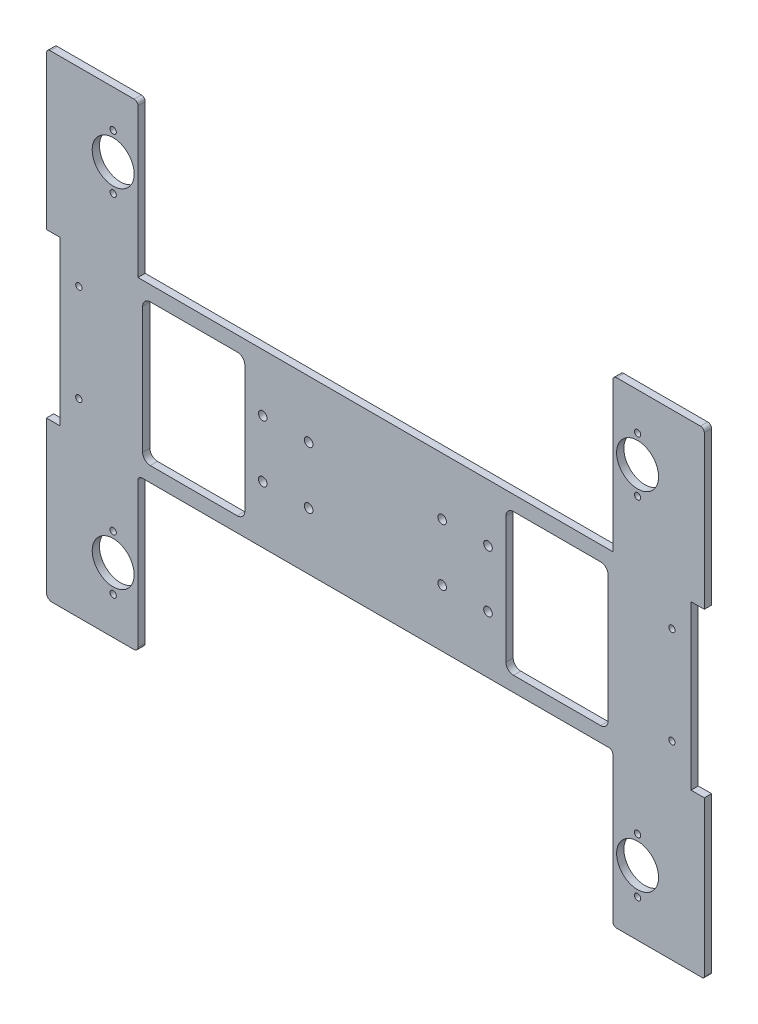
from build123d import *

# Parameters (mm, degrees)
SKETCH2_R           = 1.65
SKETCH2_R_2         = 11
SKETCH2_R_3         = 2.25
BOSS_EXTRUDE1_DEPTH = 3.8


with BuildPart() as part:
    # Sketch2 → Boss-Extrude1 (new body)
    with BuildSketch(Plane.XY):
        with BuildLine():
            Line((-170.5, 150), (-126.5, 150))
            ThreePointArc((-126.5, 150), (-125.085786438, 149.414213562), (-124.5, 148))
            Line((-124.5, 148), (-124.5, 70))
            Line((-124.5, 70), (124.5, 70))
            Line((124.5, 70), (124.5, 148))
            ThreePointArc((124.5, 148), (125.085786438, 149.414213562), (126.5, 150))
            Line((126.5, 150), (170.5, 150))
            ThreePointArc((170.5, 150), (171.914213562, 149.414213562), (172.5, 148))
            Line((172.5, 148), (172.5, 67.8042249))
            Line((172.5, 67.8042249), (165.5, 67.8042249))
            Line((165.5, 67.8042249), (165.5, -17.8042249))
            Line((165.5, -17.8042249), (172.5, -17.8042249))
            Line((172.5, -17.8042249), (172.5, -99))
            ThreePointArc((172.5, -99), (172.207106781, -99.707106781), (171.5, -100))
            Line((171.5, -100), (126.5, -100))
            ThreePointArc((126.5, -100), (125.085786438, -99.414213562), (124.5, -98))
            Line((124.5, -98), (124.5, -22))
            ThreePointArc((124.5, -22), (123.914213562, -20.585786438), (122.5, -20))
            Line((122.5, -20), (-122.5, -20))
            ThreePointArc((-122.5, -20), (-123.914213562, -20.585786438), (-124.5, -22))
            Line((-124.5, -22), (-124.5, -98))
            ThreePointArc((-124.5, -98), (-125.085786438, -99.414213562), (-126.5, -100))
            Line((-126.5, -100), (-169.5, -100))
            ThreePointArc((-169.5, -100), (-171.621320344, -99.121320344), (-172.5, -97))
            Line((-172.5, -97), (-172.5, -17.8042249))
            Line((-172.5, -17.8042249), (-165.5, -17.8042249))
            Line((-165.5, -17.8042249), (-165.5, 67.8042249))
            Line((-165.5, 67.8042249), (-172.5, 67.8042249))
            Line((-172.5, 67.8042249), (-172.5, 148))
            ThreePointArc((-172.5, 148), (-171.914213562, 149.414213562), (-170.5, 150))
        make_face()
        with Locations(Location((-137.5, 130.334802826, 0), (0, 0, 180))):
            Circle(SKETCH2_R, mode=Mode.SUBTRACT)
        with Locations(Location((-137.5, 101.665197174, 0), (0, 0, 180))):
            Circle(SKETCH2_R, mode=Mode.SUBTRACT)
        with Locations(Location((137.5, 130.334802826, 0), (0, 0, 180))):
            Circle(SKETCH2_R, mode=Mode.SUBTRACT)
        with Locations(Location((137.5, 101.665197174, 0), (0, 0, 180))):
            Circle(SKETCH2_R, mode=Mode.SUBTRACT)
        with Locations(Location((137.5, 116, 0), (0, 0, 180))):
            Circle(SKETCH2_R_2, mode=Mode.SUBTRACT)
        with Locations(Location((-137.5, 116, 0), (0, 0, 180))):
            Circle(SKETCH2_R_2, mode=Mode.SUBTRACT)
        with Locations(Location((155.5, -0.5, 0), (0, 0, 180))):
            Circle(SKETCH2_R, mode=Mode.SUBTRACT)
        with Locations(Location((155.5, 50.5, 0), (0, 0, 180))):
            Circle(SKETCH2_R, mode=Mode.SUBTRACT)
        with Locations(Location((-155.5, -0.5, 0), (0, 0, 180))):
            Circle(SKETCH2_R, mode=Mode.SUBTRACT)
        with Locations(Location((-155.5, 50.5, 0), (0, 0, 180))):
            Circle(SKETCH2_R, mode=Mode.SUBTRACT)
        with Locations(Location((-35, 10.055, 0), (0, 0, 180))):
            Circle(SKETCH2_R_3, mode=Mode.SUBTRACT)
        with Locations(Location((-35, 39.945, 0), (0, 0, 180))):
            Circle(SKETCH2_R_3, mode=Mode.SUBTRACT)
        with Locations(Location((-59.06, 39.945, 0), (0, 0, 180))):
            Circle(SKETCH2_R_3, mode=Mode.SUBTRACT)
        with Locations(Location((-59.06, 10.055, 0), (0, 0, 180))):
            Circle(SKETCH2_R_3, mode=Mode.SUBTRACT)
        with Locations(Location((59.06, 10.055, 0), (0, 0, 180))):
            Circle(SKETCH2_R_3, mode=Mode.SUBTRACT)
        with Locations(Location((35, 10.055, 0), (0, 0, 180))):
            Circle(SKETCH2_R_3, mode=Mode.SUBTRACT)
        with Locations(Location((35, 39.945, 0), (0, 0, 180))):
            Circle(SKETCH2_R_3, mode=Mode.SUBTRACT)
        with Locations(Location((59.06, 39.945, 0), (0, 0, 180))):
            Circle(SKETCH2_R_3, mode=Mode.SUBTRACT)
        with Locations(Location((137.5, -80.334802826, 0), (0, 0, 180))):
            Circle(SKETCH2_R, mode=Mode.SUBTRACT)
        with Locations(Location((137.5, -51.665197174, 0), (0, 0, 180))):
            Circle(SKETCH2_R, mode=Mode.SUBTRACT)
        with Locations(Location((137.5, -66, 0), (0, 0, 180))):
            Circle(SKETCH2_R_2, mode=Mode.SUBTRACT)
        with Locations(Location((-137.5, -66, 0), (0, 0, 180))):
            Circle(SKETCH2_R_2, mode=Mode.SUBTRACT)
        with Locations(Location((-137.5, -51.665197174, 0), (0, 0, 180))):
            Circle(SKETCH2_R, mode=Mode.SUBTRACT)
        with Locations(Location((-137.5, -80.334802826, 0), (0, 0, 180))):
            Circle(SKETCH2_R, mode=Mode.SUBTRACT)
        with BuildLine():
            Line((-72.45742566, 62.171403079), (-118.05517368, 62.171403079))
            ThreePointArc((-118.05517368, 62.171403079), (-120.883600805, 60.999830204), (-122.05517368, 58.171403079))
            Line((-122.05517368, 58.171403079), (-122.05517368, -8.171403079))
            ThreePointArc((-122.05517368, -8.171403079), (-120.883600805, -10.999830204), (-118.05517368, -12.171403079))
            Line((-118.05517368, -12.171403079), (-72.45742566, -12.171403079))
            ThreePointArc((-72.45742566, -12.171403079), (-69.628998535, -10.999830204), (-68.45742566, -8.171403079))
            Line((-68.45742566, -8.171403079), (-68.45742566, 58.171403079))
            ThreePointArc((-68.45742566, 58.171403079), (-69.628998535, 60.999830204), (-72.45742566, 62.171403079))
        make_face(mode=Mode.SUBTRACT)
        with BuildLine():
            Line((72.45742566, 62.171403079), (118.05517368, 62.171403079))
            ThreePointArc((118.05517368, 62.171403079), (120.883600805, 60.999830204), (122.05517368, 58.171403079))
            Line((122.05517368, 58.171403079), (122.05517368, -8.171403079))
            ThreePointArc((122.05517368, -8.171403079), (120.883600805, -10.999830204), (118.05517368, -12.171403079))
            Line((118.05517368, -12.171403079), (72.45742566, -12.171403079))
            ThreePointArc((72.45742566, -12.171403079), (69.628998535, -10.999830204), (68.45742566, -8.171403079))
            Line((68.45742566, -8.171403079), (68.45742566, 58.171403079))
            ThreePointArc((68.45742566, 58.171403079), (69.628998535, 60.999830204), (72.45742566, 62.171403079))
        make_face(mode=Mode.SUBTRACT)
    extrude(amount=BOSS_EXTRUDE1_DEPTH)


solid = part.part
